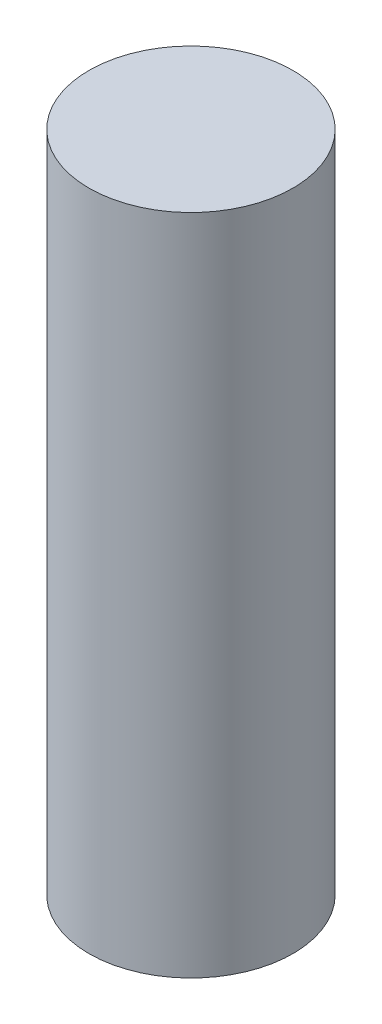
from build123d import *

# Parameters (mm, degrees)
SKETCH1_R           = 5.08
BOSS_EXTRUDE1_DEPTH = 33.02


with BuildPart() as part:
    # Sketch1 → Boss-Extrude1 (new body)
    with BuildSketch(Plane(origin=(0, 0, 0), x_dir=(1, 0, 0), z_dir=(0, 1, 0))):
        with Locations(Location((0, 0, 0), (0, 0, 270))):
            Circle(SKETCH1_R)
    extrude(amount=BOSS_EXTRUDE1_DEPTH)


solid = part.part
